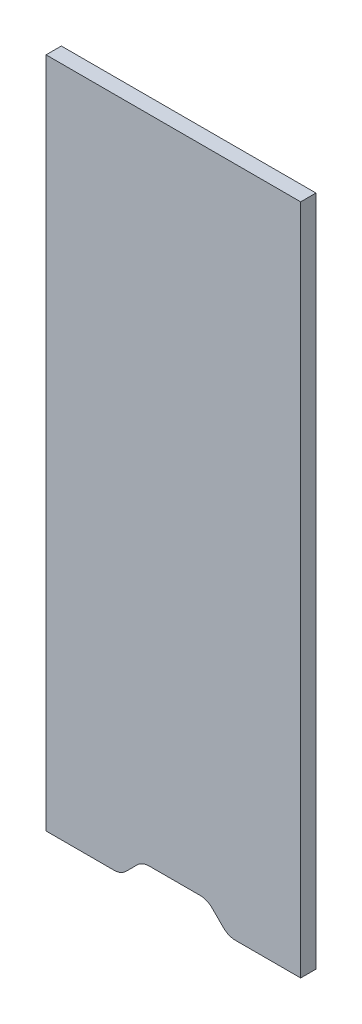
from build123d import *

# Parameters (mm, degrees)
BOSS_EXTRUDE1_DEPTH = 18


with BuildPart() as part:
    # Sketch1 → Boss-Extrude1 (new body)
    with BuildSketch(Plane.XY):
        with BuildLine():
            Line((208.994949366, 5.857864376), (195.710678119, 19.142135624))
            ThreePointArc((195.710678119, 19.142135624), (189.222211142, 23.47759065), (181.568542495, 25))
            Line((181.568542495, 25), (121.568542495, 25))
            ThreePointArc((121.568542495, 25), (113.914873848, 23.47759065), (107.426406871, 19.142135624))
            Line((107.426406871, 19.142135624), (94.142135624, 5.857864376))
            ThreePointArc((94.142135624, 5.857864376), (87.653668647, 1.52240935), (80, 0))
            Line((80, 0), (0, 0))
            Line((0, 0), (0, 792))
            Line((0, 792), (300, 792))
            Line((300, 792), (300, 0))
            Line((300, 0), (223.13708499, 0))
            ThreePointArc((223.13708499, 0), (215.483416343, 1.52240935), (208.994949366, 5.857864376))
        make_face()
    extrude(amount=BOSS_EXTRUDE1_DEPTH)


solid = part.part
